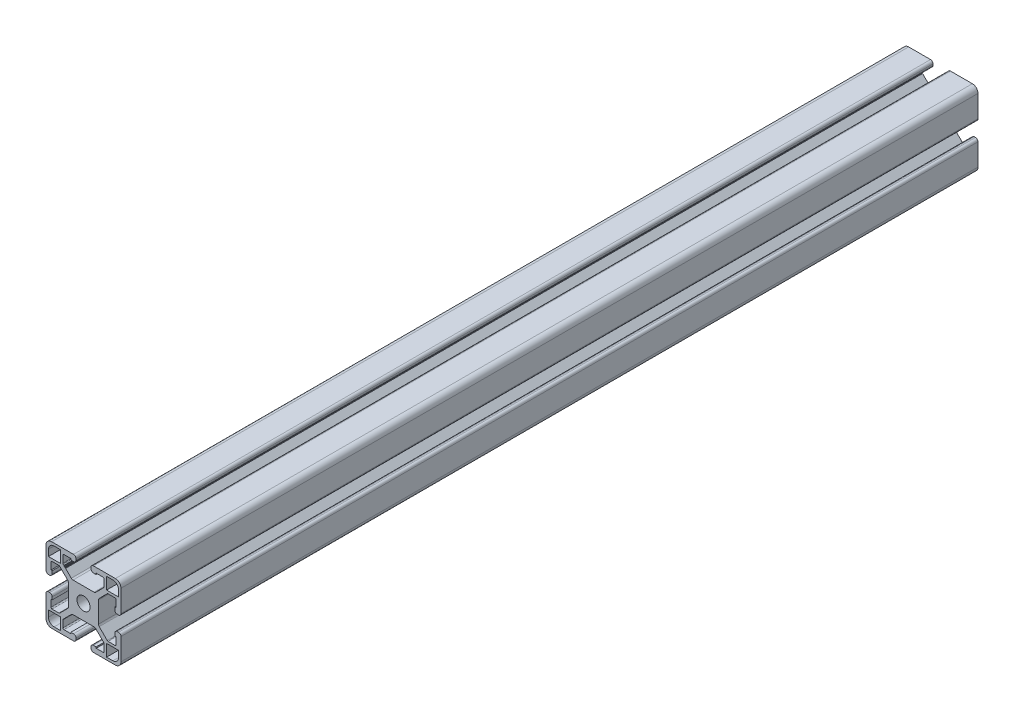
from build123d import *

# Parameters (mm, degrees)
BOSS_EXTRUDE1_DEPTH     = 228.6
CUT_EXTRUDE1_DEPTH      = 231.343135344
CUT_EXTRUDE1_DEPTH_BACK = 231.343135344


with BuildPart() as part:
    # Sketch4 → Boss-Extrude1 (new, symmetric)
    with BuildSketch(Plane.XY):
        with BuildLine():
            Line((20, -17), (20, -5.32))
            ThreePointArc((20, -5.32), (19.613380951, -4.386619049), (18.68, -4))
            Line((18.68, -4), (18.02, -4))
            ThreePointArc((18.02, -4), (17.086619049, -4.386619049), (16.7, -5.32))
            Line((16.7, -5.32), (16.7, -6.75))
            Line((16.7, -6.75), (17.36, -6.75))
            Line((17.36, -6.75), (17.36, -10.4))
            ThreePointArc((17.36, -10.4), (17.184264069, -10.824264069), (16.76, -11))
            Line((16.76, -11), (13.11529004, -11))
            ThreePointArc((13.11529004, -11), (12.88567998, -10.95432772), (12.691025971, -10.824264069))
            Line((12.691025971, -10.824264069), (8.386619049, -6.519857147))
            ThreePointArc((8.386619049, -6.519857147), (8.100479017, -6.091618326), (8, -5.586476195))
            Line((8, -5.586476195), (8, 0))
            Line((8, 0), (3.5, 0))
            ThreePointArc((3.5, 0), (2.474873734, -2.474873734), (0, -3.5))
            Line((0, -3.5), (0, -8))
            Line((0, -8), (5.586476195, -8))
            ThreePointArc((5.586476195, -8), (6.091618326, -8.100479017), (6.519857147, -8.386619049))
            Line((6.519857147, -8.386619049), (10.824264069, -12.691025971))
            ThreePointArc((10.824264069, -12.691025971), (10.95432772, -12.88567998), (11, -13.11529004))
            Line((11, -13.11529004), (11, -16.76))
            ThreePointArc((11, -16.76), (10.824264069, -17.184264069), (10.4, -17.36))
            Line((10.4, -17.36), (6.75, -17.36))
            Line((6.75, -17.36), (6.75, -16.7))
            Line((6.75, -16.7), (5.32, -16.7))
            ThreePointArc((5.32, -16.7), (4.386619049, -17.086619049), (4, -18.02))
            Line((4, -18.02), (4, -18.68))
            ThreePointArc((4, -18.68), (4.386619049, -19.613380951), (5.32, -20))
            Line((5.32, -20), (17, -20))
            ThreePointArc((17, -20), (19.121320344, -19.121320344), (20, -17))
        make_face()
        with BuildLine():
            Line((15.68, -18.68), (12.32, -18.68))
            Line((12.32, -18.68), (12.32, -12.32))
            Line((12.32, -12.32), (18.68, -12.32))
            Line((18.68, -12.32), (18.68, -15.68))
            ThreePointArc((18.68, -15.68), (17.801320344, -17.801320344), (15.68, -18.68))
        make_face(mode=Mode.SUBTRACT)
    extrude(amount=BOSS_EXTRUDE1_DEPTH, both=True)

    # Mirror1: part across plane


with BuildPart() as part_1:
    add(part.part)
    add(part.part.mirror(Plane(origin=(0, 0, 0), x_dir=(0, 0, 1), z_dir=(1, 0, 0))))

    # Mirror2: part across plane


with BuildPart() as part_2:
    add(part_1.part)
    add(part_1.part.mirror(Plane.ZX))

    # Sketch5 → Cut-Extrude1 (cut, two sides: drawn at the far end of the back side and taken through both)
    with BuildSketch(Plane.XY.offset(-CUT_EXTRUDE1_DEPTH_BACK)):
        Polygon((-10.453238098, 12.32), (-10.453238098, 11.99), (-10.123238098, 11.99), (-9.88989286, 11.756654762), (-9.88989286, 11.426654762), (-9.55989286, 11.426654762), (-9.55989286, 12.32), align=None)
    extrude(amount=CUT_EXTRUDE1_DEPTH + CUT_EXTRUDE1_DEPTH_BACK, mode=Mode.SUBTRACT)


solid = part_2.part
